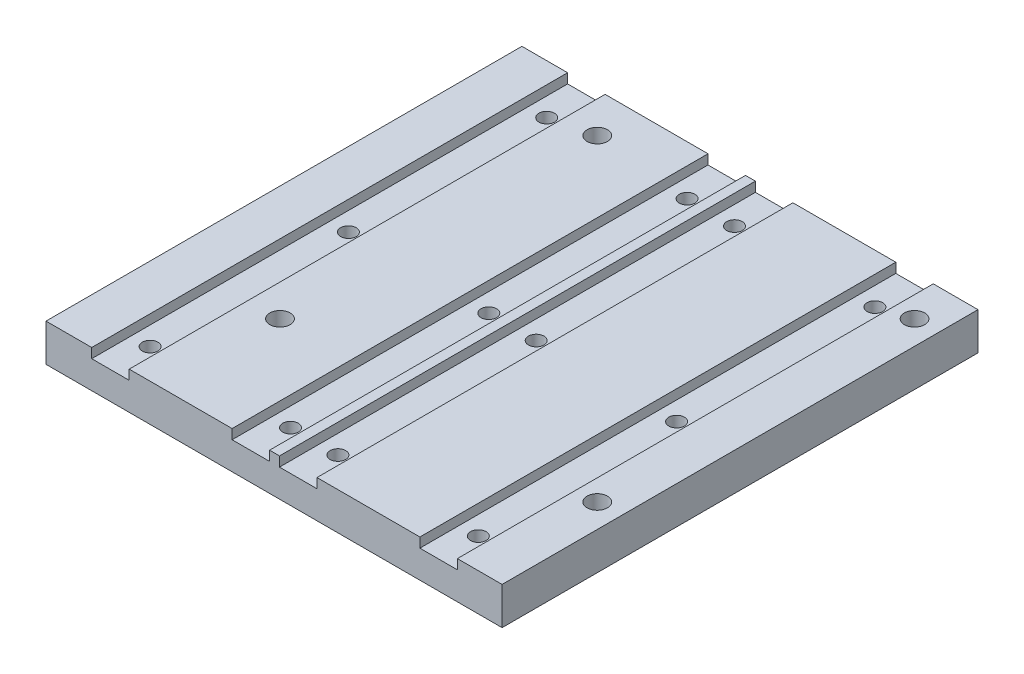
from build123d import *

# Parameters (mm, degrees)
SKETCH1_W                                       = 146.05
SKETCH1_H                                       = 152.4
BOSS_EXTRUDE1_DEPTH                             = 12
F_1_4_CLEARANCE_HOLE1_D                         = 6.5278
SKETCH4_W                                       = 12
SKETCH4_H                                       = 3.11
CUT_EXTRUDE1_DEPTH                              = 170.417858046
CBORE_FOR_10_SOCKET_HEAD_CAP_SCREW1_D           = 4.9784
CBORE_FOR_10_SOCKET_HEAD_CAP_SCREW1_CBORE_D     = 9.525
CBORE_FOR_10_SOCKET_HEAD_CAP_SCREW1_CBORE_DEPTH = 4.826
LPATTERN1_COUNT                                 = 2
LPATTERN1_PITCH                                 = 44.958
LPATTERN1_COUNT_DIR2                            = 2
LPATTERN1_PITCH_DIR2                            = 60.132999876


with BuildPart() as part:
    # Sketch1 → Boss-Extrude1 (new body)
    with BuildSketch(Plane(origin=(0, 0, 0), x_dir=(1, 0, 0), z_dir=(0, 1, 0))):
        Rectangle(SKETCH1_W, SKETCH1_H)
    extrude(amount=-BOSS_EXTRUDE1_DEPTH)

    # 1/4 Clearance Hole1 (through all)
    with Locations(Plane(origin=(0, 0, 0), x_dir=(1, 0, 0), z_dir=(0, 1, 0))):
        with Locations((-36.195, 63.5), (-36.195, -38.1), (65.405, -38.1), (65.405, 63.5)):
            Hole(F_1_4_CLEARANCE_HOLE1_D / 2)

    # Sketch4 → Cut-Extrude1 (cut, through all)
    with BuildSketch(Plane.XY.offset(76.2)):
        with Locations((52.705, -1.555)):
            Rectangle(SKETCH4_W, SKETCH4_H)
    cut_extrude1 = extrude(amount=-CUT_EXTRUDE1_DEPTH, mode=Mode.SUBTRACT)

    # CBORE for #10 Socket Head Cap Screw1 (through all)
    with Locations(Plane(origin=(0, -12, 0), x_dir=(-1, 0, 0), z_dir=(0, -1, 0))):
        with Locations((-52.705, -63.5), (-52.705, 63.5), (-52.705, 0)):
            cbore_for_10_socket_head_cap_screw1 = CounterBoreHole(CBORE_FOR_10_SOCKET_HEAD_CAP_SCREW1_D / 2, CBORE_FOR_10_SOCKET_HEAD_CAP_SCREW1_CBORE_D / 2, CBORE_FOR_10_SOCKET_HEAD_CAP_SCREW1_CBORE_DEPTH)

    # LPattern1: Cut-Extrude1, CBORE for _10 Socket Head Cap Screw1 2 × 2
    with Locations(*[Vector(-1, 0, 0) * (i * LPATTERN1_PITCH) + Vector(-1, 0, 0) * (j * LPATTERN1_PITCH_DIR2) for i in range(LPATTERN1_COUNT) for j in range(LPATTERN1_COUNT_DIR2) if (i, j) != (0, 0)]):
        add(cut_extrude1, mode=Mode.SUBTRACT)
        add(cbore_for_10_socket_head_cap_screw1, mode=Mode.SUBTRACT)


solid = part.part
